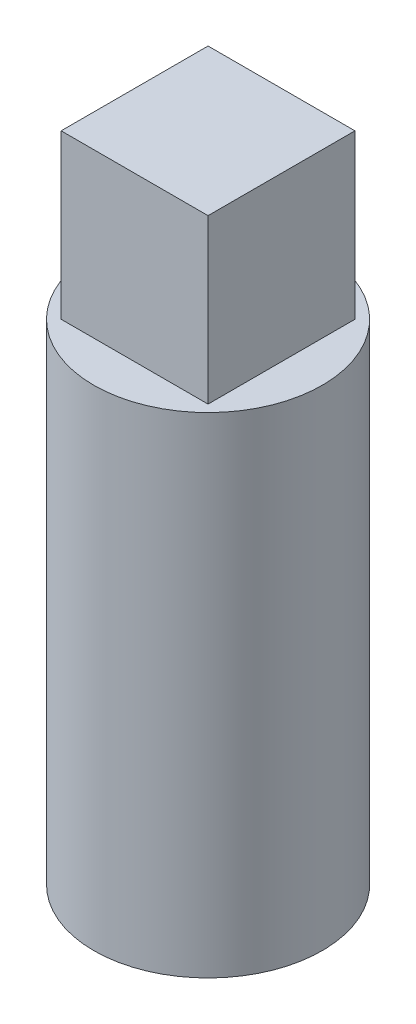
from build123d import *

# Parameters (mm, degrees)
SKETCH1_R           = 1.4
BOSS_EXTRUDE1_DEPTH = 6
SKETCH2_W           = 0.9
SKETCH2_H           = 0.9
BOSS_EXTRUDE2_DEPTH = 2


with BuildPart() as part:
    # Sketch1 → Boss-Extrude1 (new body)
    with BuildSketch(Plane(origin=(0, 0, 0), x_dir=(1, 0, 0), z_dir=(0, 1, 0))):
        with Locations(Location((0, 0, 0), (0, 0, 270))):
            Circle(SKETCH1_R)
    extrude(amount=BOSS_EXTRUDE1_DEPTH)

    # Sketch2 → Boss-Extrude2 (add)
    with BuildSketch(Plane(origin=(0, 6, 0), x_dir=(1, 0, 0), z_dir=(0, 1, 0))):
        with Locations((-0.45, 0.45)):
            Rectangle(SKETCH2_W, SKETCH2_H)
        with Locations((-0.45, -0.45)):
            Rectangle(SKETCH2_W, SKETCH2_H)
        with Locations((0.45, 0.45)):
            Rectangle(SKETCH2_W, SKETCH2_H)
        with Locations((0.45, -0.45)):
            Rectangle(SKETCH2_W, SKETCH2_H)
    extrude(amount=BOSS_EXTRUDE2_DEPTH)


solid = part.part
